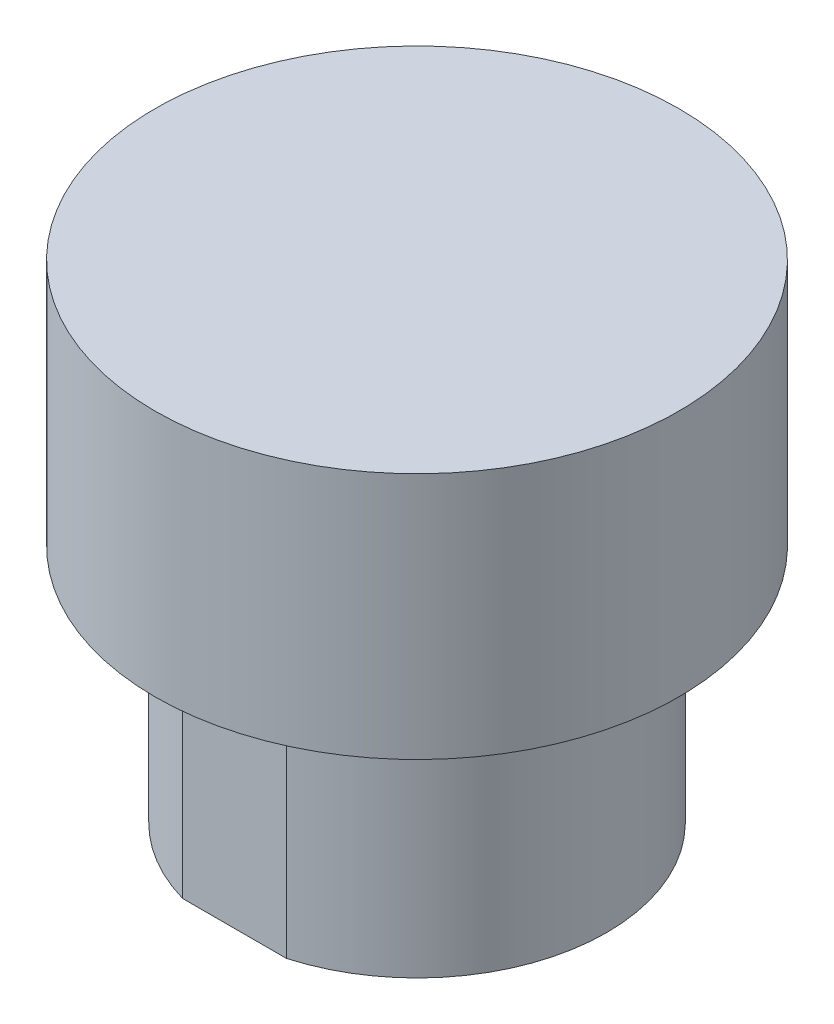
from build123d import *

# Parameters (mm, degrees)
BOSS_EXTRUDE1_DEPTH = 13.3
SKETCH2_R           = 14.5
BOSS_EXTRUDE2_DEPTH = 13.7


with BuildPart() as part:
    # Sketch1 → Boss-Extrude1 (new body)
    with BuildSketch(Plane(origin=(0, 0, 0), x_dir=(1, 0, 0), z_dir=(0, 1, 0))):
        with BuildLine():
            Line((2.870540019, 10.1), (-2.870540019, 10.1))
            ThreePointArc((-2.870540019, 10.1), (-10.5, 0), (-2.870540019, -10.1))
            Line((-2.870540019, -10.1), (2.870540019, -10.1))
            Line((2.870540019, -10.1), (2.870540019, 10.1))
        make_face()
        with BuildLine():
            ThreePointArc((10.5, 0), (8.378265638, 6.328875485), (2.870540019, 10.1))
            Line((2.870540019, 10.1), (2.870540019, -10.1))
            ThreePointArc((2.870540019, -10.1), (8.378265638, -6.328875485), (10.5, 0))
        make_face()
    extrude(amount=BOSS_EXTRUDE1_DEPTH)

    # Sketch2 → Boss-Extrude2 (add)
    with BuildSketch(Plane(origin=(0, 13.3, 0), x_dir=(1, 0, 0), z_dir=(0, 1, 0))):
        with Locations(Location((0, 0, 0), (0, 0, 90))):
            Circle(SKETCH2_R)
    extrude(amount=BOSS_EXTRUDE2_DEPTH)


solid = part.part
